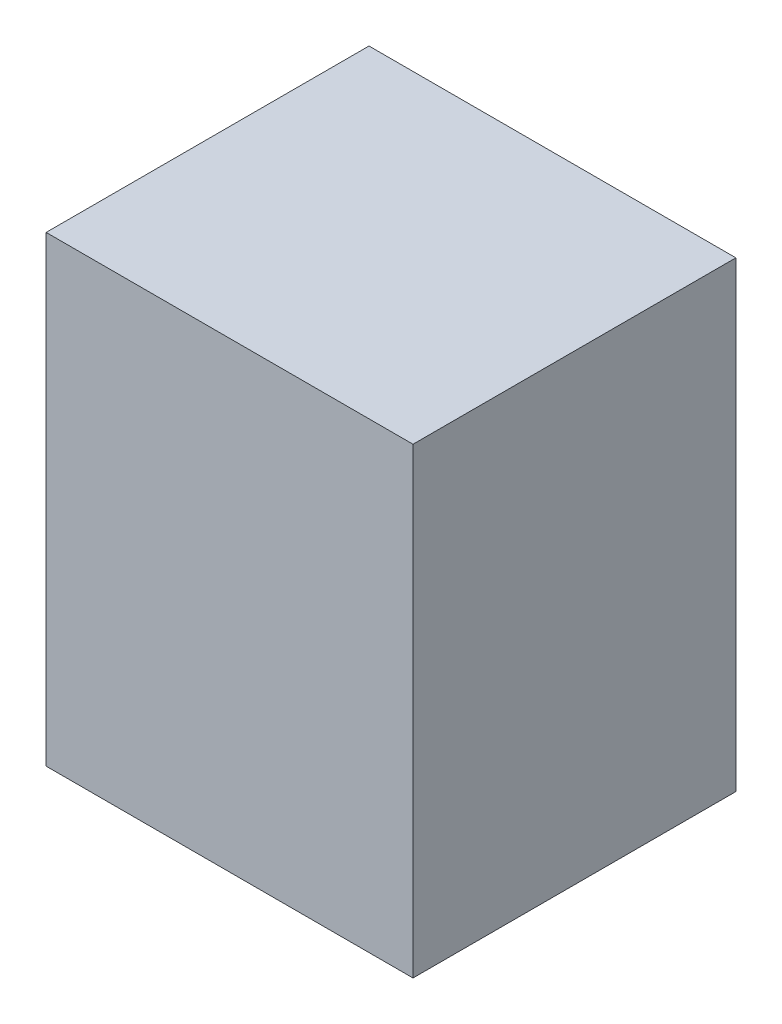
from build123d import *

# Parameters (mm, degrees)
SKETCH1_W           = 127
SKETCH1_H           = 111.76
BOSS_EXTRUDE1_DEPTH = 160.02


with BuildPart() as part:
    # Sketch1 → Boss-Extrude1 (new body)
    with BuildSketch(Plane(origin=(0, 0, 0), x_dir=(1, 0, 0), z_dir=(0, 1, 0))):
        with Locations((63.5, 55.88)):
            Rectangle(SKETCH1_W, SKETCH1_H)
    extrude(amount=BOSS_EXTRUDE1_DEPTH)


solid = part.part
